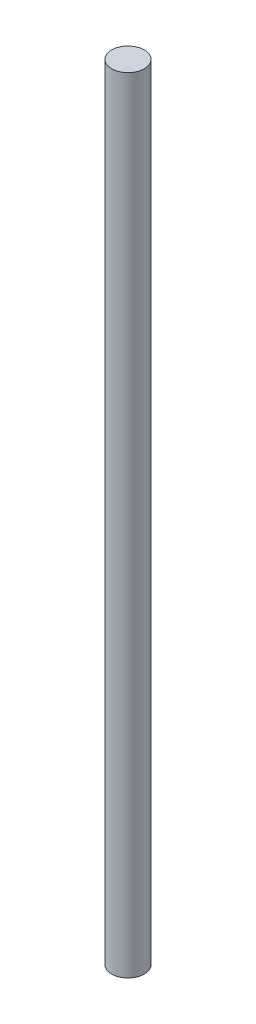
from build123d import *

# Parameters (mm, degrees)
SKETCH1_R           = 2.5
BOSS_EXTRUDE1_DEPTH = 120


with BuildPart() as part:
    # Sketch1 → Boss-Extrude1 (new body)
    with BuildSketch(Plane(origin=(0, 0, 0), x_dir=(1, 0, 0), z_dir=(0, 1, 0))):
        with Locations(Location((0, 0, 0), (0, 0, 270))):
            Circle(SKETCH1_R)
    extrude(amount=BOSS_EXTRUDE1_DEPTH)


solid = part.part
